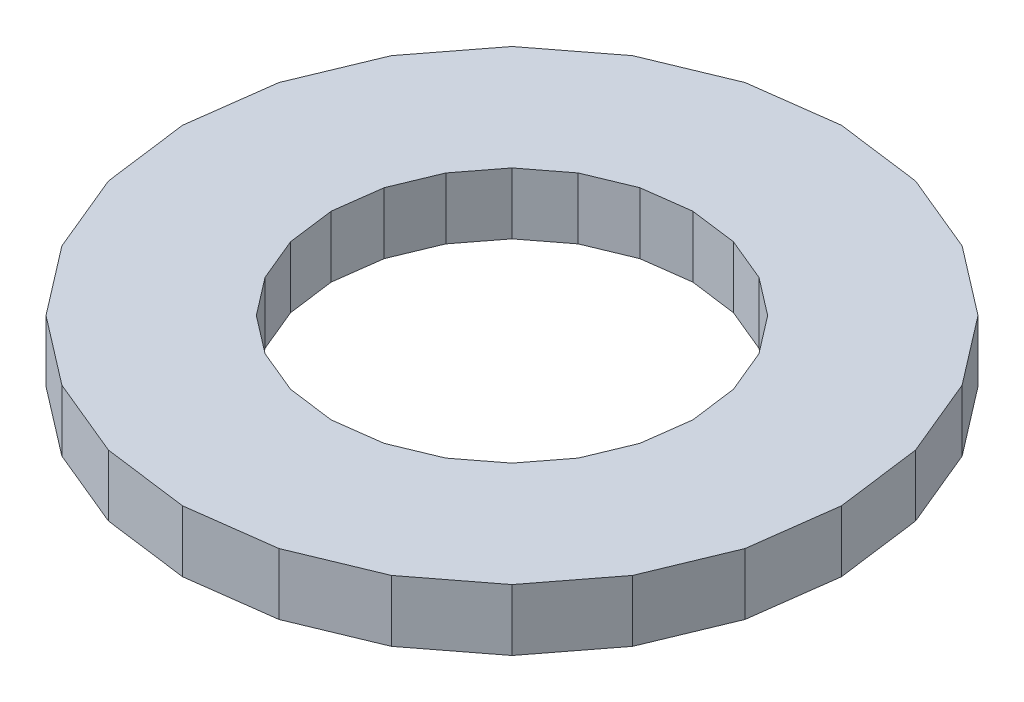
from build123d import *

# Parameters (mm, degrees)
BOSS_EXTRUDE1_DEPTH = 19.05


with BuildPart() as part:
    # Sketch1 → Boss-Extrude1 (new body)
    with BuildSketch(Plane(origin=(0, 0, 0), x_dir=(1, 0, 0), z_dir=(0, 1, 0))):
        Polygon((-102.16340317, 0), (-98.682269623, -26.441834453), (-88.476102482, -51.081701585), (-72.24043517, -72.24043517), (-51.081701585, -88.476102482), (-26.441834453, -98.682269623), (0, -102.16340317), (26.441834453, -98.682269623), (51.081701585, -88.476102482), (72.24043517, -72.24043517), (88.476102482, -51.081701585), (98.682269623, -26.441834453), (102.16340317, 0), (98.682269623, 26.441834453), (88.476102482, 51.081701585), (72.24043517, 72.24043517), (51.081701585, 88.476102482), (26.441834453, 98.682269623), (0, 102.16340317), (-26.441834453, 98.682269623), (-51.081701585, 88.476102482), (-72.24043517, 72.24043517), (-88.476102482, 51.081701585), (-98.682269623, 26.441834453), align=None)
        Polygon((-56.048887092, 0), (-54.139067577, -14.506519436), (-48.539760076, -28.024443546), (-39.632548141, -39.632548141), (-28.024443546, -48.539760076), (-14.506519436, -54.139067577), (0, -56.048887092), (14.506519436, -54.139067577), (28.024443546, -48.539760076), (39.632548141, -39.632548141), (48.539760076, -28.024443546), (54.139067577, -14.506519436), (56.048887092, 0), (54.139067577, 14.506519436), (48.539760076, 28.024443546), (39.632548141, 39.632548141), (28.024443546, 48.539760076), (14.506519436, 54.139067577), (0, 56.048887092), (-14.506519436, 54.139067577), (-28.024443546, 48.539760076), (-39.632548141, 39.632548141), (-48.539760076, 28.024443546), (-54.139067577, 14.506519436), align=None, mode=Mode.SUBTRACT)
    extrude(amount=BOSS_EXTRUDE1_DEPTH)


solid = part.part
